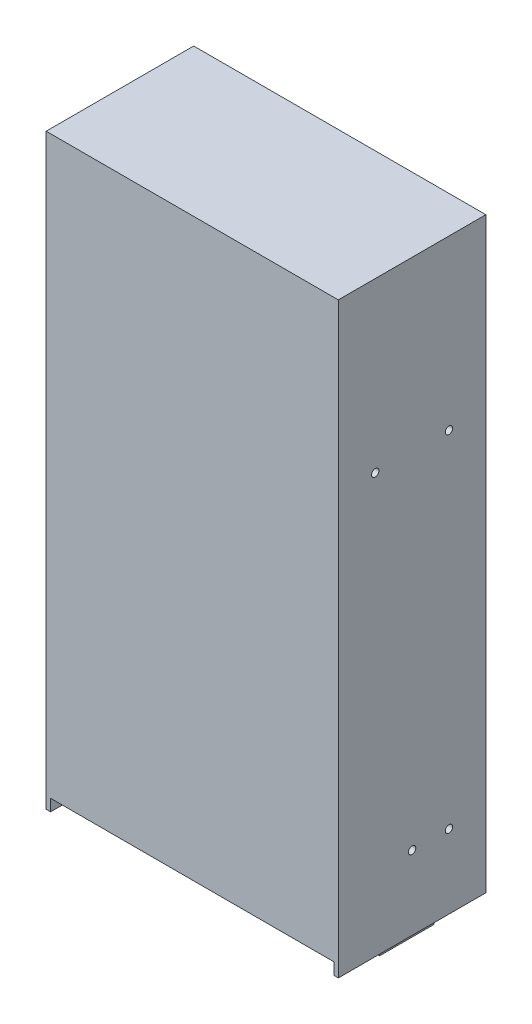
from build123d import *

# Parameters (mm, degrees)
SKETCH1_W           = 99
SKETCH1_H           = 199
BOSS_EXTRUDE1_DEPTH = 50
SKETCH2_W           = 96
SKETCH2_H           = 4
CUT_EXTRUDE1_DEPTH  = 48.5
BOSS_EXTRUDE2_REACH = 213.072
SKETCH7_W           = 58
SKETCH7_H           = 18.5
BOSS_EXTRUDE3_DEPTH = 11
SKETCH9_R           = 1.25
CUT_EXTRUDE6_DEPTH  = 131.432932958
SKETCH10_R          = 1.25
CUT_EXTRUDE7_DEPTH  = 5
CUT_EXTRUDE8_START  = -10
SKETCH11_R          = 1.25
CUT_EXTRUDE8_DEPTH  = 10


with BuildPart() as part:
    # Sketch1 → Boss-Extrude1 (new body)
    with BuildSketch(Plane.XY):
        Rectangle(SKETCH1_W, SKETCH1_H)
    extrude(amount=BOSS_EXTRUDE1_DEPTH)

    # Sketch2 → Cut-Extrude1 (cut)
    with BuildSketch(Plane.XY.offset(50)):
        with Locations((0, -97.5)):
            Rectangle(SKETCH2_W, SKETCH2_H)
    extrude(amount=-CUT_EXTRUDE1_DEPTH, mode=Mode.SUBTRACT)

    # Sketch3 → Boss-Extrude2 (add, up to next)
    with BuildSketch(Plane.XZ.offset(99.5), mode=Mode.PRIVATE) as boss_extrude2_sk1:
        Polygon((39, 1.5), (-43.455469088, 1.5), (-48, 1.5), (-48, 10.5), (-19, 10.5), (-19, 25.5), (39, 25.5), align=None)
    boss_extrude2_tool1 = extrude(boss_extrude2_sk1.sketch, amount=-BOSS_EXTRUDE2_REACH, mode=Mode.PRIVATE) - part.part
    add(boss_extrude2_tool1.solids().sort_by_distance((3.131579, -99.5, 12.315789))[0])

    # Sketch7 → Boss-Extrude3 (add)
    with BuildSketch(Plane.XZ.offset(99.5)):
        with Locations((10, 16.25)):
            Rectangle(SKETCH7_W, SKETCH7_H)
    extrude(amount=BOSS_EXTRUDE3_DEPTH)

    # Sketch9 → Cut-Extrude6 (cut, through all)
    with BuildSketch(Plane.XY.offset(1.5)):
        with Locations((11.5, -79.5)):
            Circle(SKETCH9_R)
        with Locations((-39.5, -79.5)):
            Circle(SKETCH9_R)
        with Locations((-39.5, 88.5)):
            Circle(SKETCH9_R)
        with Locations((39.5, 88.5)):
            Circle(SKETCH9_R)
    extrude(amount=-CUT_EXTRUDE6_DEPTH, mode=Mode.SUBTRACT)

    # Sketch10 → Cut-Extrude7 (cut)
    with BuildSketch(Plane(origin=(49.5, 0, 0), x_dir=(0, 0, -1), z_dir=(1, 0, 0))):
        with Locations((-37.5, 42.5)):
            Circle(SKETCH10_R)
        with Locations((-12.5, 42.5)):
            Circle(SKETCH10_R)
        with Locations((-25, -74.5)):
            Circle(SKETCH10_R)
        with Locations((-12.5, -74.5)):
            Circle(SKETCH10_R)
    extrude(amount=-CUT_EXTRUDE7_DEPTH, mode=Mode.SUBTRACT)

    # Sketch11 → Cut-Extrude8 (cut)
    with BuildSketch(Plane.ZY.offset(49.5).offset(CUT_EXTRUDE8_START)):
        with Locations(Location((12.5, -74.5, 0), (0, 0, 180))):
            Circle(SKETCH11_R)
        with Locations(Location((12.5, 42.5, 0), (0, 0, 180))):
            Circle(SKETCH11_R)
    extrude(amount=CUT_EXTRUDE8_DEPTH, mode=Mode.SUBTRACT)


solid = part.part
